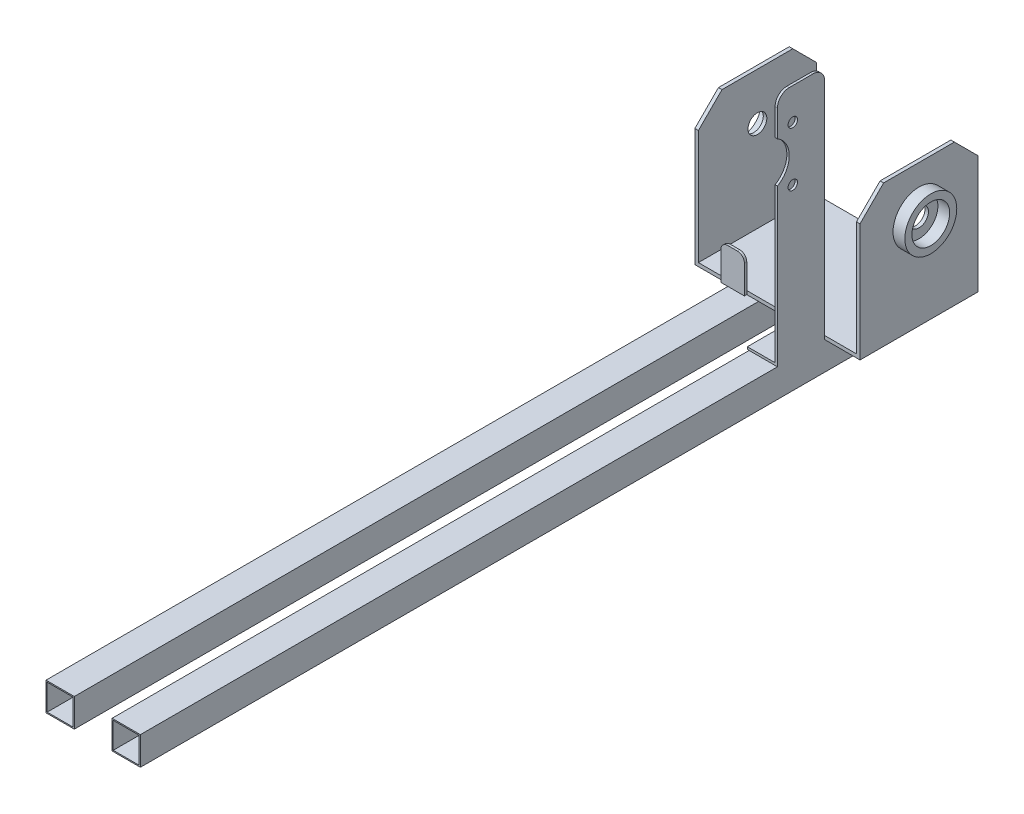
from build123d import *

# Parameters (mm, degrees)
BOSS_EXTRUDE1_DEPTH      = 50
CHAMFER1_SIZE            = 10
SKETCH2_R                = 4
CUT_EXTRUDE1_DEPTH       = 80
SKETCH3_R                = 11
SKETCH3_R_2              = 8
BOSS_EXTRUDE2_DEPTH      = 5
SKETCH4_W                = 12
SKETCH4_H                = 12
SKETCH4_W_2              = 11
SKETCH4_H_2              = 11
BOSS_EXTRUDE3_DEPTH      = 340
SKETCH5_W                = 40
SKETCH5_H                = 12
BOSS_EXTRUDE4_DEPTH      = 12
SKETCH6_W                = 11
SKETCH6_H                = 11
CUT_EXTRUDE2_DEPTH       = 67
BOSS_EXTRUDE5_DEPTH      = 20
FILLET1_R                = 5
SKETCH8_R                = 2
CUT_EXTRUDE3_DEPTH       = 20
BOSS_EXTRUDE6_DEPTH      = 3
BOSS_EXTRUDE6_DEPTH_BACK = 7
SKETCH9_W                = 1
SKETCH9_H                = 15
FILLET2_R                = 3


with BuildPart() as part:
    # Sketch1 → Boss-Extrude1 (new body)
    with BuildSketch(Plane.XY):
        Polygon((-65.816488176, 13.044356197), (-65.816488176, -46.955643803), (4.183511824, -46.955643803), (4.183511824, 13.044356197), (2.683511824, 13.044356197), (2.683511824, -45.455643803), (-64.316488176, -45.455643803), (-64.316488176, 13.044356197), align=None)
    extrude(amount=BOSS_EXTRUDE1_DEPTH)

    # Chamfer1
    chamfer1_edges = [part.edges().sort_by_distance(p)[0] for p in [
        (-65.066488176, 13.044356197, 0),
        (3.433511824, 13.044356197, 50),
        (-65.066488176, 13.044356197, 50),
        (3.433511824, 13.044356197, 0),
    ]]
    chamfer(chamfer1_edges, length=CHAMFER1_SIZE)

    # Sketch2 → Cut-Extrude1 (cut)
    with BuildSketch(Plane(origin=(4.183511824, 0, 0), x_dir=(0, 0, -1), z_dir=(1, 0, 0))):
        with Locations((-25, -6.955643803)):
            Circle(SKETCH2_R)
    extrude(amount=-CUT_EXTRUDE1_DEPTH, mode=Mode.SUBTRACT)

    # Sketch3 → Boss-Extrude2 (add)
    with BuildSketch(Plane(origin=(4.183511824, 0, 0), x_dir=(0, 0, -1), z_dir=(1, 0, 0))):
        with Locations(Location((-25, -6.955643803, 0), (0, 0, 180))):
            Circle(SKETCH3_R)
        with Locations((-25, -6.955643803)):
            Circle(SKETCH3_R_2, mode=Mode.SUBTRACT)
    boss_extrude2 = extrude(amount=BOSS_EXTRUDE2_DEPTH)

    # Mirror1: Boss-Extrude2 across plane
    add(boss_extrude2.mirror(Plane.ZY.offset(30.816488176)))

    # Sketch4 → Boss-Extrude3 (add)
    with BuildSketch(Plane(origin=(0, 0, 0), x_dir=(-1, 0, 0), z_dir=(0, 0, -1))):
        with Locations((16.816488176, -52.955643803)):
            Rectangle(SKETCH4_W, SKETCH4_H)
        with Locations((16.816488176, -52.955643803)):
            Rectangle(SKETCH4_W_2, SKETCH4_H_2, mode=Mode.SUBTRACT)
    boss_extrude3 = extrude(amount=-BOSS_EXTRUDE3_DEPTH)

    # Mirror2: Boss-Extrude3 across plane
    add(boss_extrude3.mirror(Plane.ZY.offset(30.816488176)))

    # Sketch5 → Boss-Extrude4 (add)
    with BuildSketch(Plane(origin=(0, 0, 0), x_dir=(-1, 0, 0), z_dir=(0, 0, -1))):
        with Locations((30.816488176, -52.955643803)):
            Rectangle(SKETCH5_W, SKETCH5_H)
    extrude(amount=-BOSS_EXTRUDE4_DEPTH)

    # Sketch6 → Cut-Extrude2 (cut)
    with BuildSketch(Plane(origin=(-10.816488176, 0, 0), x_dir=(0, 0, -1), z_dir=(1, 0, 0))):
        with Locations((-6, -52.955643803)):
            Rectangle(SKETCH6_W, SKETCH6_H)
    extrude(amount=-CUT_EXTRUDE2_DEPTH, mode=Mode.SUBTRACT)

    # Sketch7 → Boss-Extrude5 (add)
    with BuildSketch(Plane.XY.offset(50)):
        Polygon((-23.570169561, -45.955643803), (-11.816488176, -45.955643803), (-11.816488176, 53.044356197), (-10.816488176, 53.044356197), (-10.816488176, -46.955643803), (-23.570169561, -46.955643803), align=None)
    extrude(amount=BOSS_EXTRUDE5_DEPTH)

    # Fillet1
    fillet1_edges = [part.edges().sort_by_distance(p)[0] for p in [
        (-11.316488176, 53.044356197, 50),
        (-11.316488176, 53.044356197, 70),
    ]]
    fillet(fillet1_edges, radius=FILLET1_R)

    # Sketch8 → Cut-Extrude3 (cut)
    with BuildSketch(Plane(origin=(-10.816488176, 0, 0), x_dir=(0, 0, -1), z_dir=(1, 0, 0))):
        with Locations(Location((-63.5, 39.544356197, 0), (0, 0, 90))):
            Circle(SKETCH8_R)
        with BuildLine():
            Line((-70, 28.044356197), (-70, 19.384102159))
            ThreePointArc((-70, 19.384102159), (-66.339745962, 23.044356197), (-65, 28.044356197))
            ThreePointArc((-65, 28.044356197), (-66.339745962, 33.044356197), (-70, 36.704610234))
            Line((-70, 36.704610234), (-70, 28.044356197))
        make_face()
        with Locations(Location((-63.5, 16.544356197, 0), (0, 0, 90))):
            Circle(SKETCH8_R)
    extrude(amount=-CUT_EXTRUDE3_DEPTH, mode=Mode.SUBTRACT)

    # Sketch9 → Boss-Extrude6 (add, two sides: drawn at the far end of the back side and taken through both)
    with BuildSketch(Plane.ZY.offset(50.816488176).offset(-BOSS_EXTRUDE6_DEPTH_BACK)):
        with Locations((50.5, -39.455643803)):
            Rectangle(SKETCH9_W, SKETCH9_H)
    extrude(amount=BOSS_EXTRUDE6_DEPTH + BOSS_EXTRUDE6_DEPTH_BACK)

    # Fillet2
    fillet2_edges = [part.edges().sort_by_distance(p)[0] for p in [
        (-43.816488176, -31.955643803, 50.5),
        (-53.816488176, -31.955643803, 50.5),
    ]]
    fillet(fillet2_edges, radius=FILLET2_R)


solid = part.part
